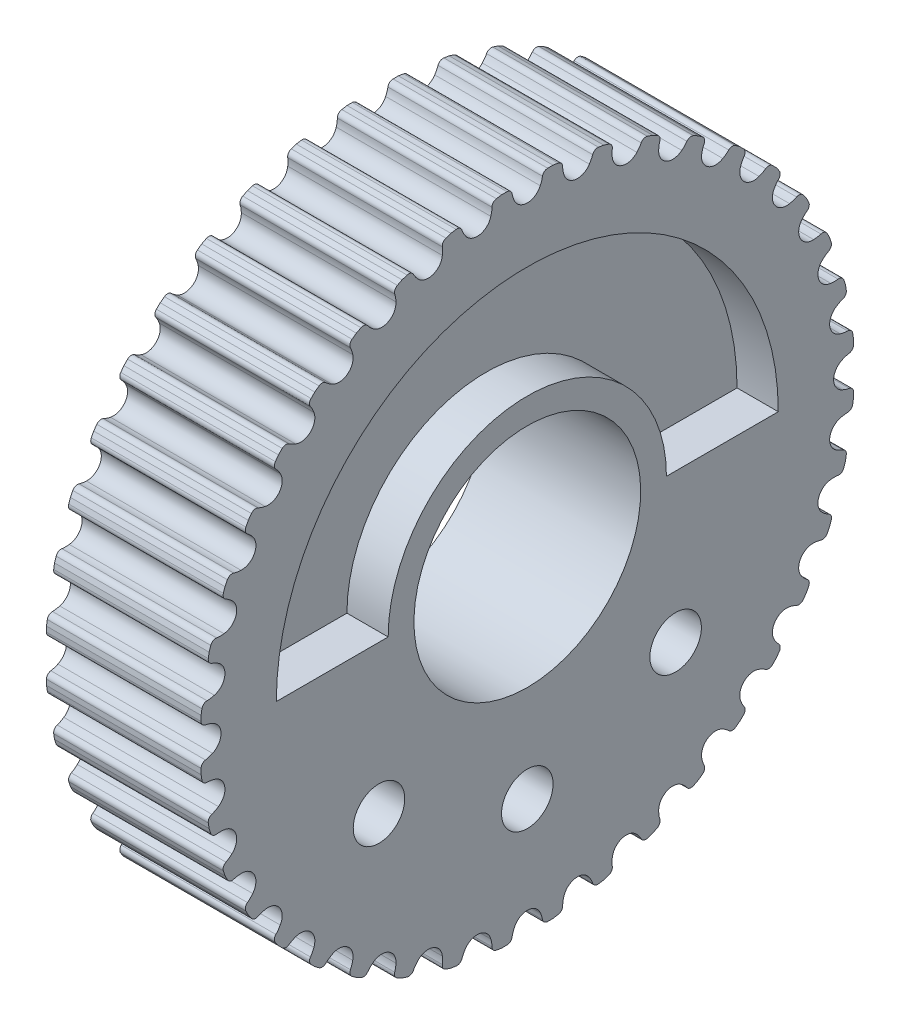
from build123d import *

# Parameters (mm, degrees)
CUT_EXTRUDE2_DEPTH  = 48.474677461
CIRPATTERN1_COUNT   = 40
SKETCH3_R           = 11
CUT_EXTRUDE3_DEPTH  = 48.204981123
BOSS_EXTRUDE1_DEPTH = 15
SKETCH5_R           = 2.5
CUT_EXTRUDE4_DEPTH  = 15


with BuildPart() as part:
    # Sketch1 → Revolve1 (revolve)
    with BuildSketch(Plane.XY):
        Polygon((-44.101095662, 0), (-44.101095662, 13.5), (-48.101095662, 13.5), (-48.101095662, 24.35), (-44.101095662, 24.35), (-44.101095662, 31.85), (-59.101095662, 31.85), (-59.101095662, 24.35), (-55.101095662, 24.35), (-55.101095662, 13.5), (-59.101095662, 13.5), (-59.101095662, 0), align=None)
    revolve(axis=Axis((85.267559773, 0, 0), (-1, 0, 0)))

    # Sketch2 → Cut-Extrude2 (cut, through all)
    with BuildSketch(Plane.ZY.offset(59.101095662)):
        with BuildLine():
            Line((-1.977058363, 31.648935549), (-2.5, 31.648935549))
            Line((-2.5, 31.648935549), (-2.5, 33.518935549))
            Line((-2.5, 33.518935549), (2.5, 33.518935549))
            Line((2.5, 33.518935549), (2.5, 31.648935549))
            Line((2.5, 31.648935549), (1.977058363, 31.648935549))
            ThreePointArc((1.977058363, 31.648935549), (1.647962732, 31.528545695), (1.474238768, 31.224214238))
            ThreePointArc((1.474238768, 31.224214238), (1.389274836, 30.875172493), (1.255919029, 30.541608049))
            ThreePointArc((1.255919029, 30.541608049), (0, 29.718935549), (-1.255919029, 30.541608049))
            ThreePointArc((-1.255919029, 30.541608049), (-1.389274836, 30.875172493), (-1.474238768, 31.224214238))
            ThreePointArc((-1.474238768, 31.224214238), (-1.647962732, 31.528545695), (-1.977058363, 31.648935549))
        make_face()
    cut_extrude2 = extrude(amount=-CUT_EXTRUDE2_DEPTH, mode=Mode.SUBTRACT)

    # CirPattern1: Cut-Extrude2 ×40 about axis
    cirpattern1_axis = Axis((0, 0, 0), (1, 0, 0))
    for i in range(1, CIRPATTERN1_COUNT):
        add(cut_extrude2.rotate(cirpattern1_axis, i * 360 / CIRPATTERN1_COUNT), mode=Mode.SUBTRACT)

    # Sketch3 → Cut-Extrude3 (cut, through all)
    with BuildSketch(Plane.ZY.offset(59.101095662)):
        with Locations(Location((0, 0, 0), (0, 0, 270))):
            Circle(SKETCH3_R)
    extrude(amount=-CUT_EXTRUDE3_DEPTH, mode=Mode.SUBTRACT)

    # Sketch4 → Boss-Extrude1 (add)
    with BuildSketch(Plane.ZY.offset(59.101095662)):
        with BuildLine():
            Line((-28.2, 0), (-12.5, 0))
            ThreePointArc((-12.5, 0), (0, -12.5), (12.5, 0))
            Line((12.5, 0), (28.2, 0))
            ThreePointArc((28.2, 0), (0, -28.2), (-28.2, 0))
        make_face()
    extrude(amount=-BOSS_EXTRUDE1_DEPTH)

    # Sketch5 → Cut-Extrude4 (cut)
    with BuildSketch(Plane.ZY.offset(59.101095662)):
        with Locations(Location((0, -20.35, 0), (0, 0, 270))):
            Circle(SKETCH5_R)
        with Locations(Location((-14.389622997, -14.389622997, 0), (0, 0, 270))):
            Circle(SKETCH5_R)
        with Locations(Location((14.389622997, -14.389622997, 0), (0, 0, 270))):
            Circle(SKETCH5_R)
    extrude(amount=-CUT_EXTRUDE4_DEPTH, mode=Mode.SUBTRACT)


solid = part.part
